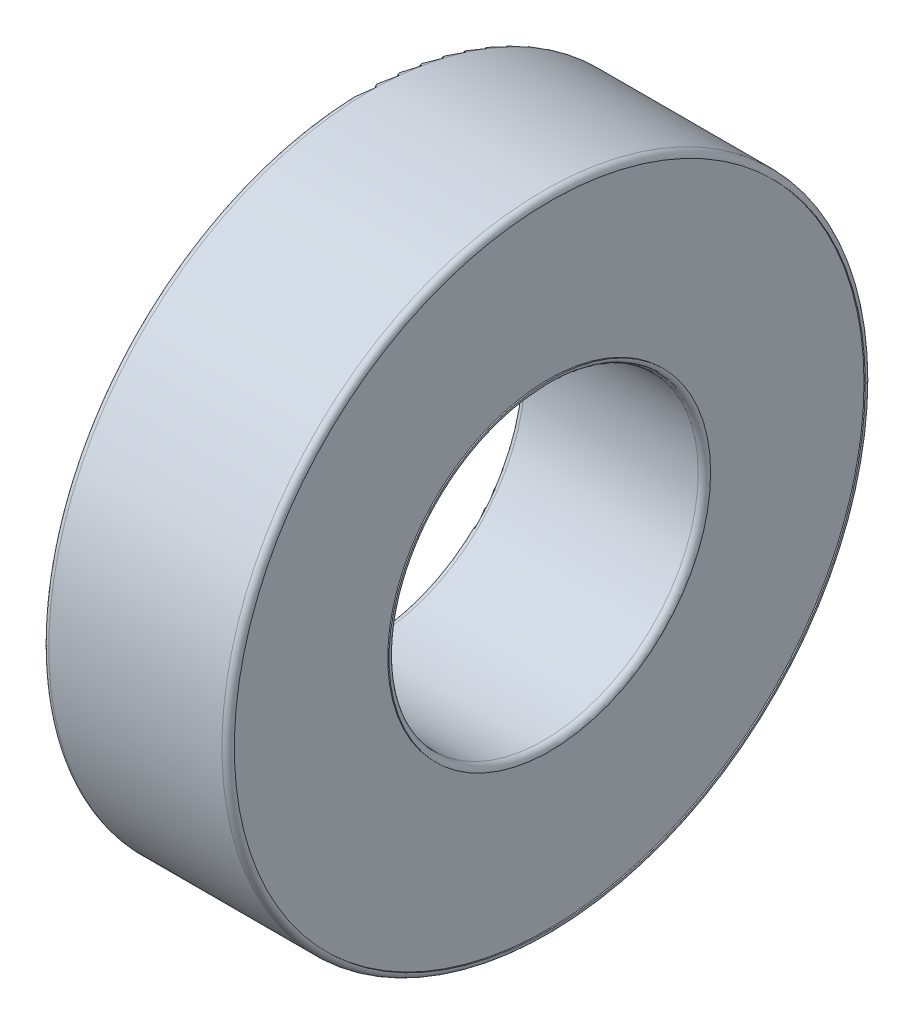
from build123d import *

# Parameters (mm, degrees)
SKETCH1_R                = 26
SKETCH1_R_2              = 12.5
BASE_EXTRUDE_DEPTH       = 15
RACCORDO1_R              = 0.5
SCHIZZO1_R               = 25.5
SCHIZZO1_R_2             = 13
TAGLIO_ESTRUSIONE1_DEPTH = 0.1
TAGLIO_ESTRUSIONE2_START = -0.1
SCHIZZO2_R               = 25.5
SCHIZZO2_R_2             = 13
TAGLIO_ESTRUSIONE2_DEPTH = 0.1


with BuildPart() as part:
    # Sketch1 → Base-Extrude (new body)
    with BuildSketch(Plane(origin=(0, 0, 0), x_dir=(0, 0, -1), z_dir=(1, 0, 0))):
        Circle(SKETCH1_R)
        Circle(SKETCH1_R_2, mode=Mode.SUBTRACT)
    extrude(amount=BASE_EXTRUDE_DEPTH)

    # Raccordo1
    raccordo1_edges = [part.edges().sort_by_distance(p)[0] for p in [
        (0, 0, 26),
        (15, 0, 26),
        (0, 0, 12.5),
        (15, 0, 12.5),
    ]]
    fillet(raccordo1_edges, radius=RACCORDO1_R)

    # Schizzo1 → Taglio-Estrusione1 (cut)
    with BuildSketch(Plane.ZY):
        Circle(SCHIZZO1_R)
        Circle(SCHIZZO1_R_2, mode=Mode.SUBTRACT)
    extrude(amount=-TAGLIO_ESTRUSIONE1_DEPTH, mode=Mode.SUBTRACT)

    # Schizzo2 → Taglio-Estrusione2 (cut)
    with BuildSketch(Plane(origin=(15, 0, 0), x_dir=(0, 0, -1), z_dir=(1, 0, 0)).offset(TAGLIO_ESTRUSIONE2_START)):
        with Locations(Location((0, 0, 0), (0, 0, 180))):
            Circle(SCHIZZO2_R)
        with Locations(Location((0, 0, 0), (0, 0, 180))):
            Circle(SCHIZZO2_R_2, mode=Mode.SUBTRACT)
    extrude(amount=TAGLIO_ESTRUSIONE2_DEPTH, mode=Mode.SUBTRACT)


solid = part.part
